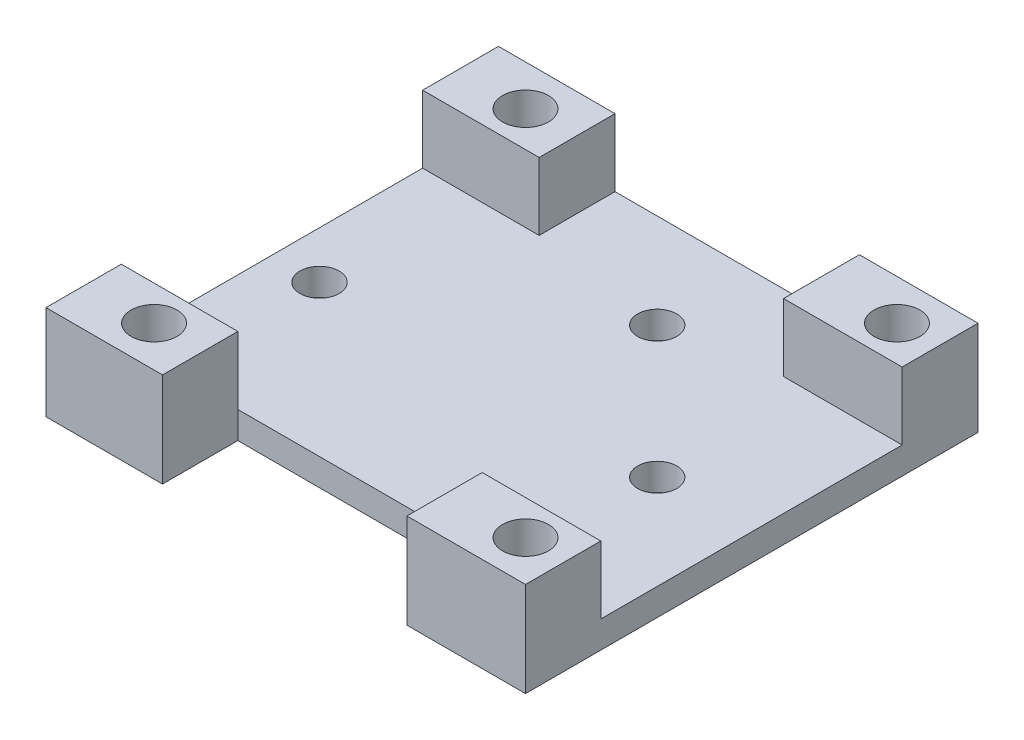
from build123d import *

# Parameters (mm, degrees)
SKETCH1_W              = 40
SKETCH1_H              = 33.5
BOSS_EXTRUDE1_DEPTH    = 7
M3_CLEARANCE_HOLE1_D   = 3.4
SKETCH4_W              = 31.219256934
SKETCH4_H              = 27.926271275
CUT_EXTRUDE1_DEPTH     = 5
SKETCH5_W              = 8.780743066
SKETCH5_H              = 22.309556891
CUT_EXTRUDE2_DEPTH     = 5
M2_5_CLEARANCE_HOLE2_D = 2.9
SKETCH12_W             = 26.872555909
SKETCH12_H             = 5.573728725
CUT_EXTRUDE4_DEPTH     = 28.010414658
SKETCH13_W             = 8.780743066
SKETCH13_H             = 5.573728725
BOSS_EXTRUDE2_DEPTH    = 7
SKETCH14_W             = 13.127444091
SKETCH14_H             = 5.616714384
BOSS_EXTRUDE3_DEPTH    = 5
M3_CLEARANCE_HOLE2_D   = 3.4
SKETCH17_W             = 4.5
SKETCH17_H             = 33.5
CUT_EXTRUDE5_DEPTH     = 28.010414658


with BuildPart() as part:
    # Sketch1 → Boss-Extrude1 (new body)
    with BuildSketch(Plane(origin=(0, 0, 0), x_dir=(1, 0, 0), z_dir=(0, 1, 0))):
        Rectangle(SKETCH1_W, SKETCH1_H)
    extrude(amount=BOSS_EXTRUDE1_DEPTH)

    # M3 Clearance Hole1 (through all)
    with Locations(Plane(origin=(-10.5, 7, 13.75), x_dir=(0, 0, 1), z_dir=(0, 1, 0))):
        with Locations((0, 0), (-27.5, 27.5)):
            Hole(M3_CLEARANCE_HOLE1_D / 2)

    # Sketch4 → Cut-Extrude1 (cut)
    with BuildSketch(Plane(origin=(0, 7, 0), x_dir=(1, 0, 0), z_dir=(0, 1, 0))):
        with Locations((-4.390371533, 2.786864362)):
            Rectangle(SKETCH4_W, SKETCH4_H)
    extrude(amount=-CUT_EXTRUDE1_DEPTH, mode=Mode.SUBTRACT)

    # Sketch5 → Cut-Extrude2 (cut)
    with BuildSketch(Plane(origin=(0, 7, 0), x_dir=(1, 0, 0), z_dir=(0, 1, 0))):
        with Locations((15.609628467, -0.02149283)):
            Rectangle(SKETCH5_W, SKETCH5_H)
    extrude(amount=-CUT_EXTRUDE2_DEPTH, mode=Mode.SUBTRACT)

    # M2.5 Clearance Hole2 (through all)
    with Locations(Plane(origin=(-12, 2, 0), x_dir=(0, 0, 1), z_dir=(0, 1, 0))):
        with Locations((0, 0), (0, 25), (-9.75, 15.25)):
            Hole(M2_5_CLEARANCE_HOLE2_D / 2)

    # Sketch12 → Cut-Extrude4 (cut, through all)
    with BuildSketch(Plane(origin=(0, 7, 0), x_dir=(1, 0, 0), z_dir=(0, 1, 0))):
        with Locations((6.563722045, -13.963135638)):
            Rectangle(SKETCH12_W, SKETCH12_H)
    extrude(amount=-CUT_EXTRUDE4_DEPTH, mode=Mode.SUBTRACT)

    # Sketch13 → Boss-Extrude2 (add)
    with BuildSketch(Plane.XZ):
        with Locations((15.609628467, 13.963135638)):
            Rectangle(SKETCH13_W, SKETCH13_H)
    extrude(amount=-BOSS_EXTRUDE2_DEPTH)

    # Sketch14 → Boss-Extrude3 (add)
    with BuildSketch(Plane(origin=(0, 2, 0), x_dir=(1, 0, 0), z_dir=(0, 1, 0))):
        with Locations((-13.436277954, 13.941642808)):
            Rectangle(SKETCH14_W, SKETCH14_H)
    extrude(amount=BOSS_EXTRUDE3_DEPTH)

    # M3 Clearance Hole2 (through all)
    with Locations(Plane(origin=(0, 7, 0), x_dir=(1, 0, 0), z_dir=(0, 1, 0))):
        with Locations((-10.5, 13.75), (17, -13.75)):
            Hole(M3_CLEARANCE_HOLE2_D / 2)

    # Sketch17 → Cut-Extrude5 (cut, through all)
    with BuildSketch(Plane(origin=(0, 7, 0), x_dir=(1, 0, 0), z_dir=(0, 1, 0))):
        with Locations((-17.75, 0)):
            Rectangle(SKETCH17_W, SKETCH17_H)
    extrude(amount=-CUT_EXTRUDE5_DEPTH, mode=Mode.SUBTRACT)


solid = part.part
